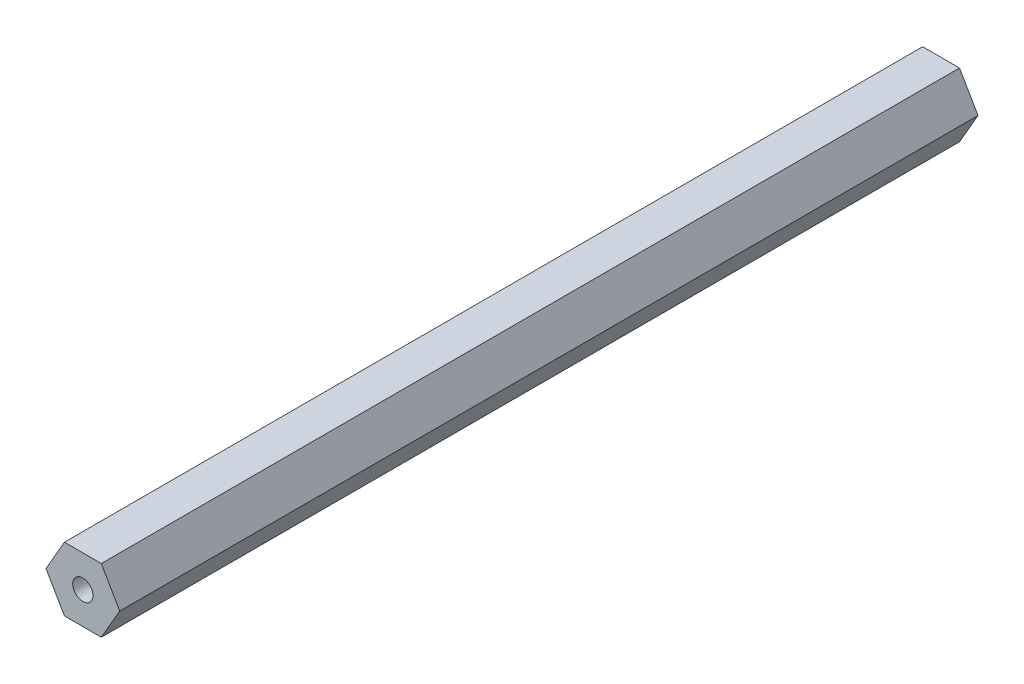
from build123d import *

# Parameters (mm, degrees)
SKETCH1_R           = 2.0193
BOSS_EXTRUDE1_DEPTH = 170.65625


with BuildPart() as part:
    # Sketch1 → Boss-Extrude1 (new body)
    with BuildSketch(Plane.XY):
        Polygon((7.332348419, 0), (3.666174209, 6.35), (-3.666174209, 6.35), (-7.332348419, 0), (-3.666174209, -6.35), (3.666174209, -6.35), align=None)
        Circle(SKETCH1_R, mode=Mode.SUBTRACT)
    extrude(amount=BOSS_EXTRUDE1_DEPTH)


solid = part.part
